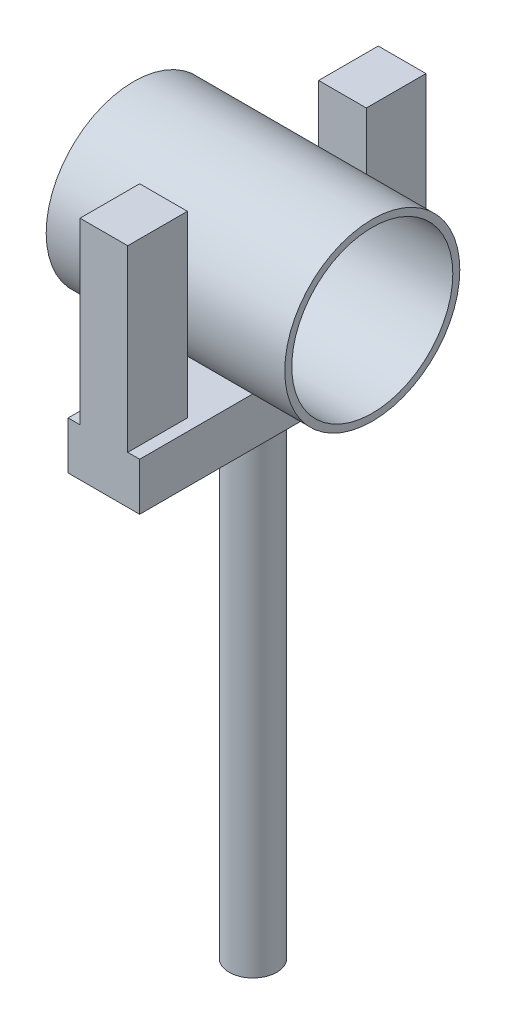
from build123d import *

# Parameters (mm, degrees)
SKETCH1_R                = 10
BOSS_EXTRUDE1_DEPTH      = 200
BOSS_EXTRUDE2_DEPTH      = 15
BOSS_EXTRUDE2_DEPTH_BACK = 15
SKETCH2_W                = 125
SKETCH2_H                = 20
BOSS_EXTRUDE3_DEPTH      = 10
BOSS_EXTRUDE3_DEPTH_BACK = 10
SKETCH3_W                = 25
SKETCH3_H                = 75
BOSS_EXTRUDE4_DEPTH      = 50
BOSS_EXTRUDE4_DEPTH_BACK = 50
SKETCH4_R                = 36.687155129
SKETCH5_R                = 33.75
CUT_EXTRUDE2_DEPTH       = 95


with BuildPart() as part:
    # Sketch1 → Boss-Extrude1 (new body)
    with BuildSketch(Plane(origin=(0, 0, 0), x_dir=(1, 0, 0), z_dir=(0, 1, 0))):
        Circle(SKETCH1_R)
    extrude(amount=BOSS_EXTRUDE1_DEPTH)

    # Sketch2 → Boss-Extrude2 (add, two sides: drawn at the far end of the back side and taken through both)
    with BuildSketch(Plane(origin=(0, 0, 0), x_dir=(0, 0, -1), z_dir=(1, 0, 0)).offset(-BOSS_EXTRUDE2_DEPTH_BACK)):
        with Locations((0, 210)):
            Rectangle(SKETCH2_W, SKETCH2_H)
    extrude(amount=BOSS_EXTRUDE2_DEPTH + BOSS_EXTRUDE2_DEPTH_BACK)

    # Sketch3 → Boss-Extrude3 (add, two sides: drawn at the far end of the back side and taken through both)
    with BuildSketch(Plane(origin=(0, 0, 0), x_dir=(0, 0, -1), z_dir=(1, 0, 0)).offset(-BOSS_EXTRUDE3_DEPTH_BACK)):
        with Locations((-50, 257.5)):
            Rectangle(SKETCH3_W, SKETCH3_H)
        with Locations((50, 257.5)):
            Rectangle(SKETCH3_W, SKETCH3_H)
    extrude(amount=BOSS_EXTRUDE3_DEPTH + BOSS_EXTRUDE3_DEPTH_BACK)


with BuildPart() as body_2:
    # Sketch4 → Boss-Extrude4 (new, two sides: drawn at the far end of the back side and taken through both)
    with BuildSketch(Plane(origin=(0, 0, 0), x_dir=(0, 0, -1), z_dir=(1, 0, 0)).offset(-BOSS_EXTRUDE4_DEPTH_BACK)):
        with Locations((0, 256.687155129)):
            Circle(SKETCH4_R)
    extrude(amount=BOSS_EXTRUDE4_DEPTH + BOSS_EXTRUDE4_DEPTH_BACK)

    # Sketch5 → Cut-Extrude2 (cut)
    with BuildSketch(Plane(origin=(50, 0, 0), x_dir=(0, 0, -1), z_dir=(1, 0, 0))):
        with Locations((0, 256.687155129)):
            Circle(SKETCH5_R)
    extrude(amount=-CUT_EXTRUDE2_DEPTH, mode=Mode.SUBTRACT)


solid = Compound([part.part, body_2.part])
